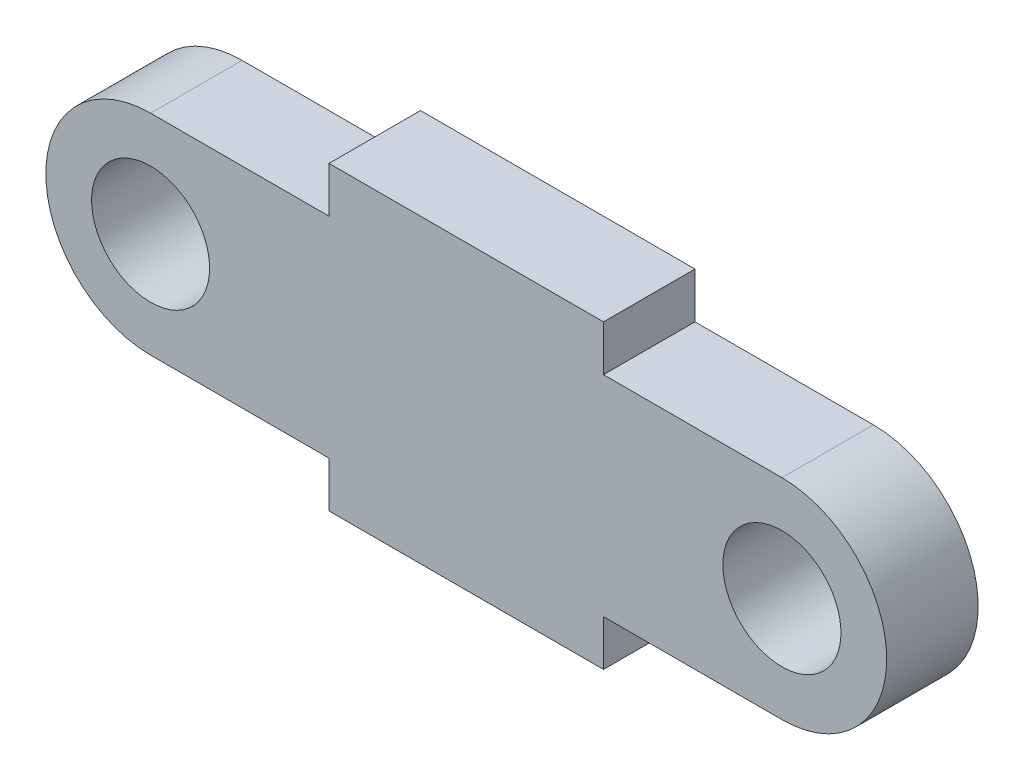
from build123d import *

# Parameters (mm, degrees)
SKETCH1_R           = 6.45
BOSS_EXTRUDE1_DEPTH = 10


with BuildPart() as part:
    # Sketch1 → Boss-Extrude1 (new body)
    with BuildSketch(Plane.XY):
        with BuildLine():
            Line((-39.617521433, 11.45), (-20.117521433, 11.45))
            Line((-20.117521433, 11.45), (-20.117521433, 16.45))
            Line((-20.117521433, 16.45), (9.882478567, 16.45))
            Line((9.882478567, 16.45), (9.882478567, 11.45))
            Line((9.882478567, 11.45), (29.382478567, 11.45))
            ThreePointArc((29.382478567, 11.45), (40.832478567, 0), (29.382478567, -11.45))
            Line((29.382478567, -11.45), (9.882478567, -11.45))
            Line((9.882478567, -11.45), (9.882478567, -16.45))
            Line((9.882478567, -16.45), (-20.117521433, -16.45))
            Line((-20.117521433, -16.45), (-20.117521433, -11.45))
            Line((-20.117521433, -11.45), (-39.617521433, -11.45))
            ThreePointArc((-39.617521433, -11.45), (-51.067521433, 0), (-39.617521433, 11.45))
        make_face()
        with Locations((-39.617521433, 0)):
            Circle(SKETCH1_R, mode=Mode.SUBTRACT)
        with Locations(Location((29.382478567, 0, 0), (0, 0, 180))):
            Circle(SKETCH1_R, mode=Mode.SUBTRACT)
    extrude(amount=-BOSS_EXTRUDE1_DEPTH)


solid = part.part
